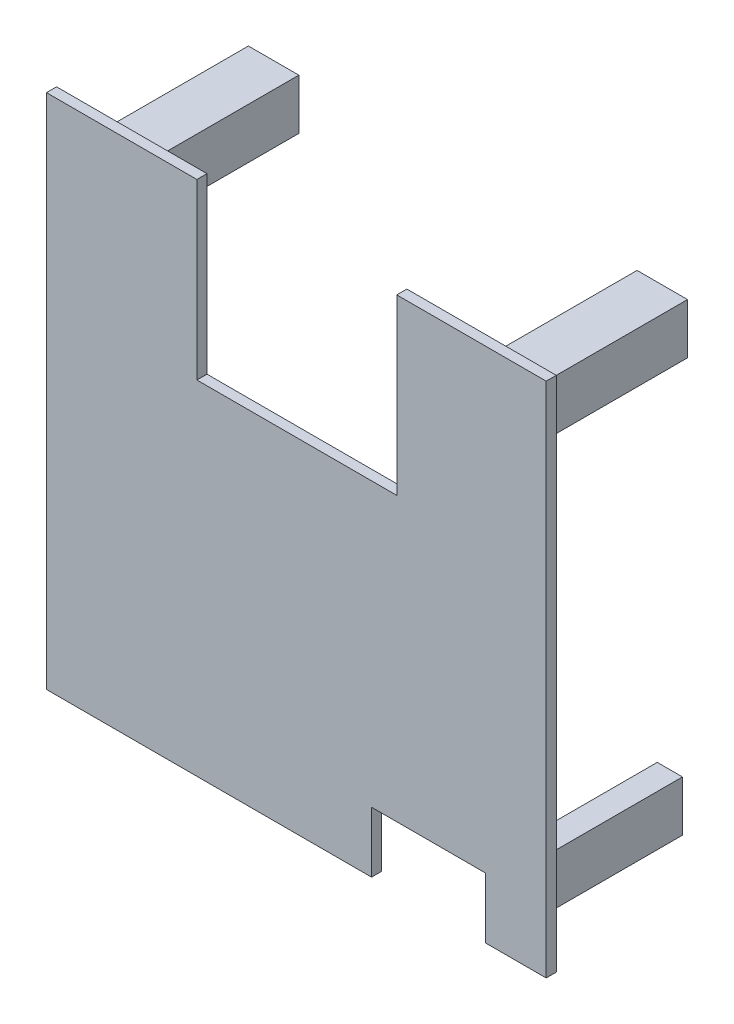
from build123d import *

# Parameters (mm, degrees)
ESQUISSE1_W             = 49.5
ESQUISSE1_H             = 51.2
BOSS_EXTRU_1_DEPTH      = 1
ESQUISSE2_W             = 11.3
ESQUISSE2_H             = 6
ESQUISSE2_W_2           = 19.8
ESQUISSE2_H_2           = 17.2
ENL_V_MAT_EXTRU_1_DEPTH = 5
ESQUISSE4_W             = 5
ESQUISSE4_H             = 5
BOSS_EXTRU_3_DEPTH      = 16
ESQUISSE5_W             = 2.5
ESQUISSE5_H             = 5
BOSS_EXTRU_4_DEPTH      = 16
ESQUISSE6_W             = 5
ESQUISSE6_H             = 5
BOSS_EXTRU_5_DEPTH      = 16
ESQUISSE7_W             = 4
ESQUISSE7_H             = 4
BOSS_EXTRU_6_DEPTH      = 16


with BuildPart() as part:
    # Esquisse1 → Boss.-Extru.1 (new body)
    with BuildSketch(Plane.XY):
        with Locations((-1.366863252, -9.011290323)):
            Rectangle(ESQUISSE1_W, ESQUISSE1_H)
    extrude(amount=BOSS_EXTRU_1_DEPTH)

    # Esquisse2 → Enlèv. mat.-Extru.1 (cut)
    with BuildSketch(Plane.XY.offset(1)):
        with Locations((11.733136748, -31.611290323)):
            Rectangle(ESQUISSE2_W, ESQUISSE2_H)
        with Locations((-1.316863252, 7.988709677)):
            Rectangle(ESQUISSE2_W_2, ESQUISSE2_H_2)
    extrude(amount=-ENL_V_MAT_EXTRU_1_DEPTH, mode=Mode.SUBTRACT)

    # Esquisse4 → Boss.-Extru.3 (add)
    with BuildSketch(Plane(origin=(0, 0, 0), x_dir=(-1, 0, 0), z_dir=(0, 0, -1))):
        with Locations((20.616863252, 11.088709677)):
            Rectangle(ESQUISSE4_W, ESQUISSE4_H)
    extrude(amount=BOSS_EXTRU_3_DEPTH)

    # Esquisse5 → Boss.-Extru.4 (add)
    with BuildSketch(Plane(origin=(0, 0, 0), x_dir=(-1, 0, 0), z_dir=(0, 0, -1))):
        with Locations((-18.633136748, -30.111290323)):
            Rectangle(ESQUISSE5_W, ESQUISSE5_H)
    extrude(amount=BOSS_EXTRU_4_DEPTH)

    # Esquisse6 → Boss.-Extru.5 (add)
    with BuildSketch(Plane(origin=(0, 0, 0), x_dir=(-1, 0, 0), z_dir=(0, 0, -1))):
        with Locations((-17.883136748, 11.088709677)):
            Rectangle(ESQUISSE6_W, ESQUISSE6_H)
    extrude(amount=BOSS_EXTRU_5_DEPTH)

    # Esquisse7 → Boss.-Extru.6 (add)
    with BuildSketch(Plane(origin=(0, 0, 0), x_dir=(-1, 0, 0), z_dir=(0, 0, -1))):
        with Locations((21.116863252, -29.611290323)):
            Rectangle(ESQUISSE7_W, ESQUISSE7_H)
    extrude(amount=BOSS_EXTRU_6_DEPTH)


solid = part.part
